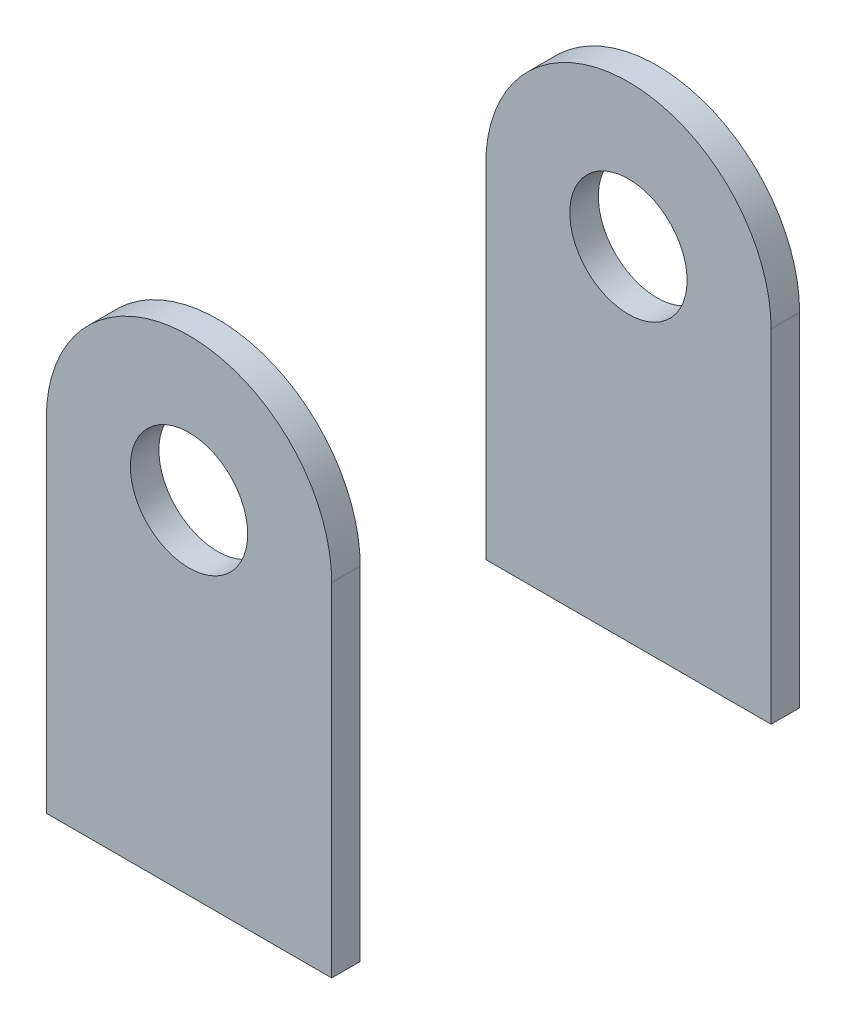
from build123d import *

# Parameters (mm, degrees)
BOSS_EXTRUDE1_START = 11.43
SKETCH1_R           = 3.2639
BOSS_EXTRUDE1_DEPTH = 1.5875
BOSS_EXTRUDE2_START = -11.43
SKETCH1_4_R         = 3.2639
BOSS_EXTRUDE2_DEPTH = 1.5875


with BuildPart() as part:
    # Sketch1 → Boss-Extrude1 (new body)
    with BuildSketch(Plane.XY.offset(BOSS_EXTRUDE1_START)):
        with BuildLine():
            ThreePointArc((7.9375, 0), (0, 7.9375), (-7.9375, 0))
            Line((-7.9375, 0), (-7.9375, -19.05))
            Line((-7.9375, -19.05), (7.9375, -19.05))
            Line((7.9375, -19.05), (7.9375, 0))
        make_face()
        Circle(SKETCH1_R, mode=Mode.SUBTRACT)
    extrude(amount=BOSS_EXTRUDE1_DEPTH)


with BuildPart() as body_2:
    # Sketch1<4> → Boss-Extrude2 (new body)
    with BuildSketch(Plane.XY.offset(BOSS_EXTRUDE2_START)):
        with BuildLine():
            ThreePointArc((7.9375, 0), (0, 7.9375), (-7.9375, 0))
            Line((-7.9375, 0), (-7.9375, -19.05))
            Line((-7.9375, -19.05), (7.9375, -19.05))
            Line((7.9375, -19.05), (7.9375, 0))
        make_face()
        Circle(SKETCH1_4_R, mode=Mode.SUBTRACT)
    extrude(amount=-BOSS_EXTRUDE2_DEPTH)


solid = Compound([part.part, body_2.part])
